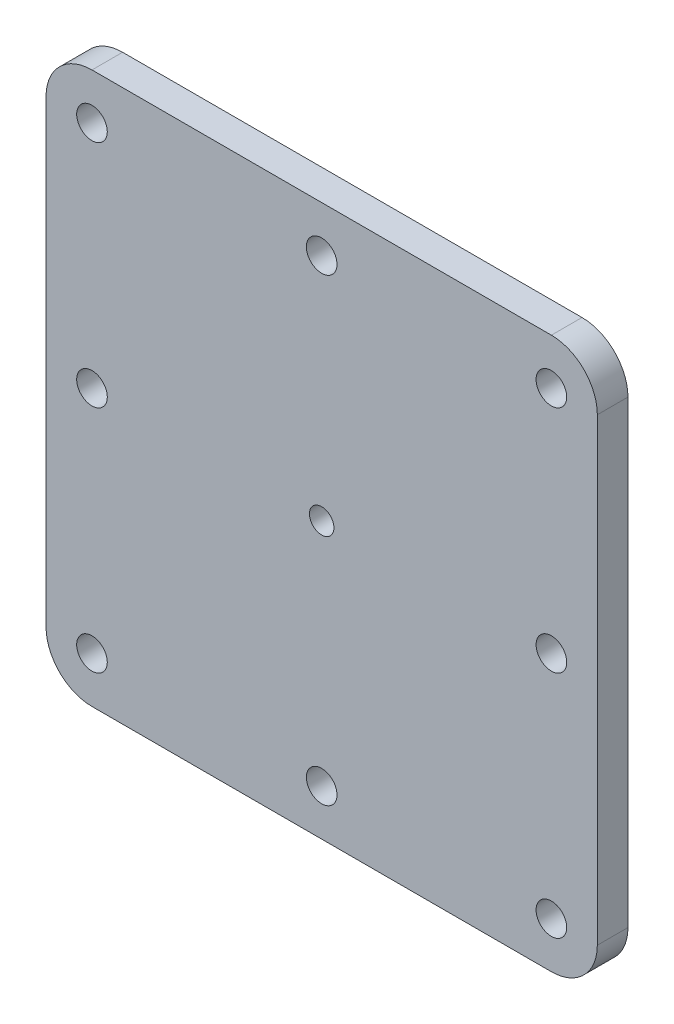
from build123d import *

# Parameters (mm, degrees)
SKETCH2_R           = 5
BOSS_EXTRUDE1_DEPTH = 10
SKETCH3_R           = 4
CUT_EXTRUDE1_DEPTH  = 10


with BuildPart() as part:
    # Sketch2 → Boss-Extrude1 (new body)
    with BuildSketch(Plane.XY):
        with BuildLine():
            Line((-75, 90), (75, 90))
            ThreePointArc((75, 90), (85.606601718, 85.606601718), (90, 75))
            Line((90, 75), (90, -75))
            ThreePointArc((90, -75), (85.606601718, -85.606601718), (75, -90))
            Line((75, -90), (-75, -90))
            ThreePointArc((-75, -90), (-85.606601718, -85.606601718), (-90, -75))
            Line((-90, -75), (-90, 75))
            ThreePointArc((-90, 75), (-85.606601718, 85.606601718), (-75, 90))
        make_face()
        with Locations((-75, 75)):
            Circle(SKETCH2_R, mode=Mode.SUBTRACT)
        with Locations((0, 75)):
            Circle(SKETCH2_R, mode=Mode.SUBTRACT)
        with Locations((75, 75)):
            Circle(SKETCH2_R, mode=Mode.SUBTRACT)
        with Locations((-75, 0)):
            Circle(SKETCH2_R, mode=Mode.SUBTRACT)
        with Locations((75, 0)):
            Circle(SKETCH2_R, mode=Mode.SUBTRACT)
        with Locations((-75, -75)):
            Circle(SKETCH2_R, mode=Mode.SUBTRACT)
        with Locations((0, -75)):
            Circle(SKETCH2_R, mode=Mode.SUBTRACT)
        with Locations((75, -75)):
            Circle(SKETCH2_R, mode=Mode.SUBTRACT)
    extrude(amount=BOSS_EXTRUDE1_DEPTH)

    # Sketch3 → Cut-Extrude1 (cut)
    with BuildSketch(Plane.XY.offset(10)):
        Circle(SKETCH3_R)
    extrude(amount=-CUT_EXTRUDE1_DEPTH, mode=Mode.SUBTRACT)


solid = part.part
